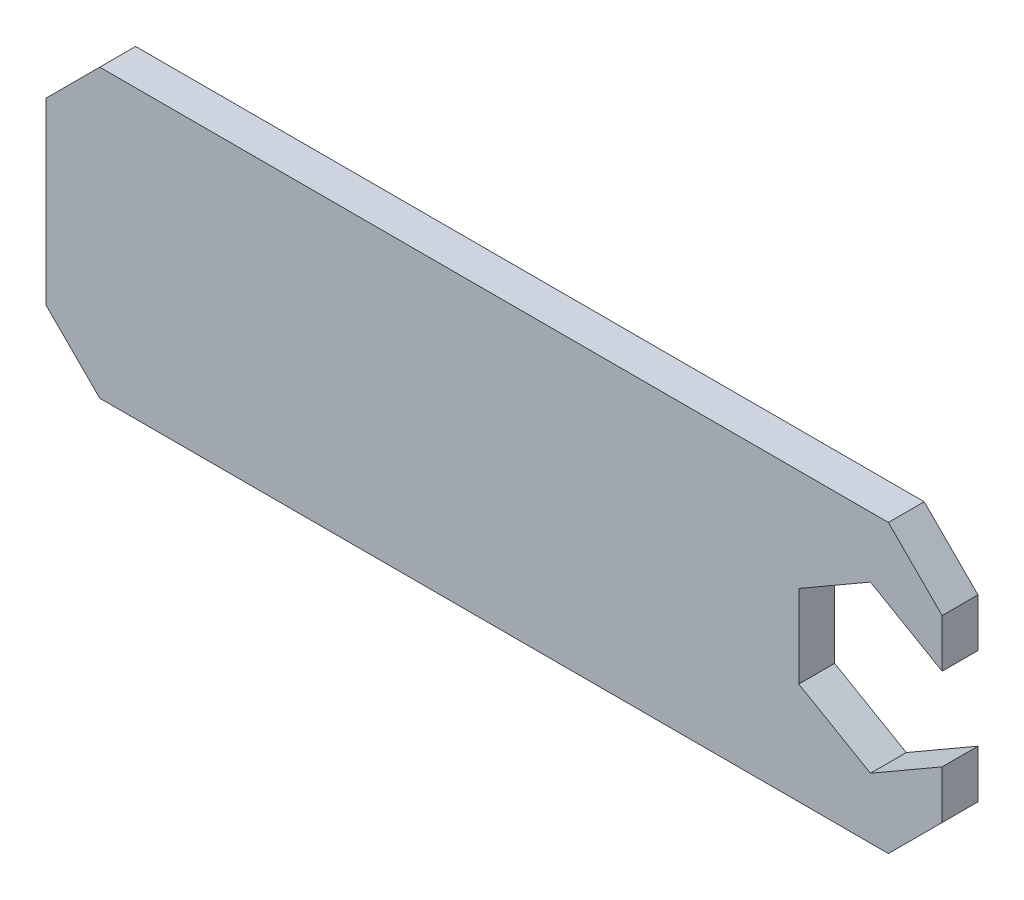
from build123d import *

# Parameters (mm, degrees)
EXTRUDE_1_DEPTH     = 2
CUT_EXTRUDE_1_DEPTH = 10


with BuildPart() as part:
    # 스케치1 → 보스-돌출1 (new body)
    with BuildSketch(Plane.XY):
        Polygon((3, 16), (0, 13), (0, 3), (3, 0), (47, 0), (50, 3), (50, 13), (47, 16), align=None)
    extrude(amount=EXTRUDE_1_DEPTH)

    # 스케치2 → 컷-돌출1 (cut)
    with BuildSketch(Plane.XY.offset(2)):
        Polygon((46, 12.618802154), (42, 10.309401077), (42, 5.690598923), (46, 3.381197846), (50, 5.690598923), (50, 10.309401077), align=None)
    extrude(amount=-CUT_EXTRUDE_1_DEPTH, mode=Mode.SUBTRACT)


solid = part.part
